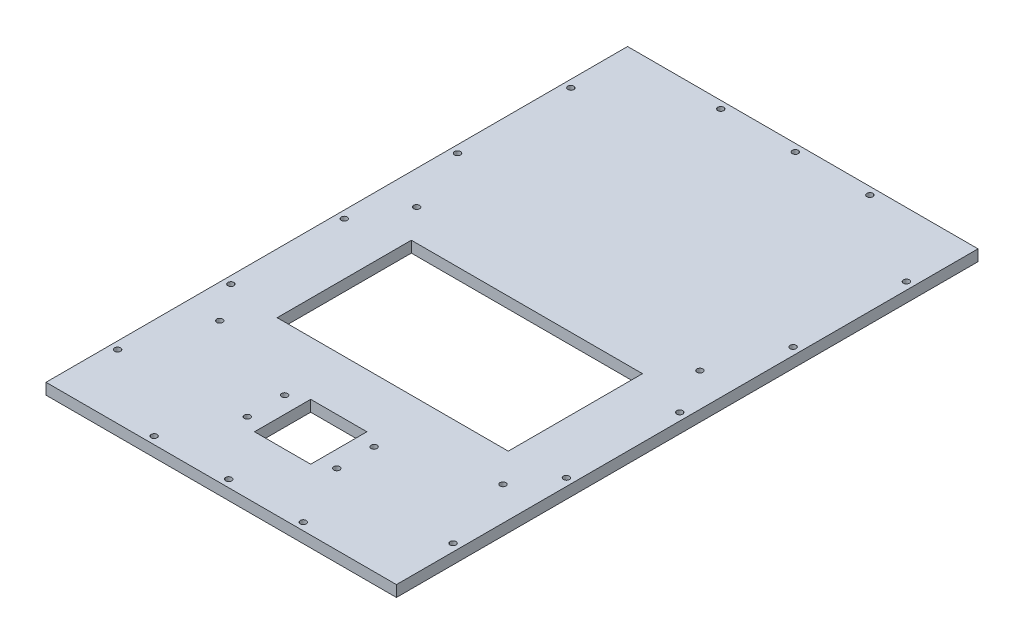
from build123d import *

# Parameters (mm, degrees)
SKETCH1_W                  = 298.45
SKETCH1_H                  = 495.3
BOSS_EXTRUDE1_DEPTH        = 4.7625
CUT_EXTRUDE1_DEPTH         = 290.291114191
CUT_EXTRUDE1_DEPTH_BACK    = 290.291114191
SKETCH3_W                  = 196.85
SKETCH3_H                  = 114.3
SKETCH20_W                 = 47.879
SKETCH20_H                 = 47.879
CUT_EXTRUDE5_DEPTH         = 290.291114191
F_10_CLEARANCE_HOLE1_D     = 5.1054
F_10_CLEARANCE_HOLE1_DEPTH = 10.668
F_10_CLEARANCE_HOLE1_TIP   = 1.533816902
F_10_CLEARANCE_HOLE4_D     = 5.1054
LPATTERN3_COUNT            = 3
LPATTERN3_PITCH            = 63.5
MIRROR2_COPY_1_D           = 5.1054
MIRROR2_COPY_2_D           = 5.1054
F_10_CLEARANCE_HOLE5_D     = 5.1054
LPATTERN4_COUNT            = 3
LPATTERN4_PITCH            = 96.52
LPATTERN4_COL_COUNT        = 3
LPATTERN4_COL_PITCH        = 96.52
MIRROR3_COPY_1_D           = 5.1054
MIRROR3_COPY_2_D           = 5.1054
MIRROR3_COPY_3_D           = 5.1054
MIRROR3_COPY_4_D           = 5.1054
F_10_CLEARANCE_HOLE6_D     = 5.1054


with BuildPart() as part:
    # Sketch1 → Boss-Extrude1 (new, symmetric)
    with BuildSketch(Plane(origin=(0, 0, 0), x_dir=(1, 0, 0), z_dir=(0, 1, 0))):
        Rectangle(SKETCH1_W, SKETCH1_H)
    extrude(amount=BOSS_EXTRUDE1_DEPTH, both=True)

    # Sketch3 → Cut-Extrude1 (cut, two sides: drawn at the far end of the back side and taken through both)
    with BuildSketch(Plane(origin=(0, 4.7625, 0), x_dir=(1, 0, 0), z_dir=(0, 1, 0)).offset(-CUT_EXTRUDE1_DEPTH_BACK)):
        with Locations((0, -44.45)):
            Rectangle(SKETCH3_W, SKETCH3_H)
    extrude(amount=CUT_EXTRUDE1_DEPTH + CUT_EXTRUDE1_DEPTH_BACK, mode=Mode.SUBTRACT)

    # Sketch20 → Cut-Extrude5 (cut, through all)
    with BuildSketch(Plane.XZ.offset(4.7625)):
        with Locations((0, 171.45)):
            Rectangle(SKETCH20_W, SKETCH20_H)
    extrude(amount=-CUT_EXTRUDE5_DEPTH, mode=Mode.SUBTRACT)

    # #10 Clearance Hole1
    with Locations(Plane(origin=(0, -4.7625, 0), x_dir=(-1, 0, 0), z_dir=(0, -1, 0))):
        with Locations((-38.1, -155.575), (38.1, -155.575), (38.1, -187.325), (-38.1, -187.325)):
            Hole(F_10_CLEARANCE_HOLE1_D / 2, depth=F_10_CLEARANCE_HOLE1_DEPTH)
            with Locations((0, 0, -(F_10_CLEARANCE_HOLE1_DEPTH + F_10_CLEARANCE_HOLE1_TIP / 2))):  # 118° drill point
                Cone(0, F_10_CLEARANCE_HOLE1_D / 2, F_10_CLEARANCE_HOLE1_TIP, mode=Mode.SUBTRACT)

    # #10 Clearance Hole4 (through all)
    with Locations(Plane(origin=(0, 4.7625, 0), x_dir=(1, 0, 0), z_dir=(0, 1, 0))):
        with Locations((-63.5, 241.3)):
            f_10_clearance_hole4 = Hole(F_10_CLEARANCE_HOLE4_D / 2)

    # LPattern3: #10 Clearance Hole4 ×3
    with Locations(*[(i * LPATTERN3_PITCH, 0, 0) for i in range(1, LPATTERN3_COUNT)]):
        add(f_10_clearance_hole4, mode=Mode.SUBTRACT)

    # Mirror2: #10 Clearance Hole4 across plane
    add(f_10_clearance_hole4.mirror(Plane.XY), mode=Mode.SUBTRACT)

    # Mirror2 copy 1 (through all)
    with Locations(Plane(origin=(63.5, 4.7625, 0), x_dir=(1, 0, 0), z_dir=(0, 1, 0))):
        with Locations((-63.5, -241.3)):
            Hole(MIRROR2_COPY_1_D / 2)

    # Mirror2 copy 2 (through all)
    with Locations(Plane(origin=(127, 4.7625, 0), x_dir=(1, 0, 0), z_dir=(0, 1, 0))):
        with Locations((-63.5, -241.3)):
            Hole(MIRROR2_COPY_2_D / 2)

    # #10 Clearance Hole5 (through all)
    with Locations(Plane(origin=(0, 4.7625, 0), x_dir=(1, 0, 0), z_dir=(0, 1, 0))):
        with Locations((-142.875, 0)):
            f_10_clearance_hole5 = Hole(F_10_CLEARANCE_HOLE5_D / 2)

    # LPattern4: #10 Clearance Hole5 ×3
    with Locations(*[(0, 0, -i * LPATTERN4_PITCH) for i in range(1, LPATTERN4_COUNT)]):
        add(f_10_clearance_hole5, mode=Mode.SUBTRACT)

    # LPattern4 col: #10 Clearance Hole5 ×3
    with Locations(*[(0, 0, i * LPATTERN4_COL_PITCH) for i in range(1, LPATTERN4_COL_COUNT)]):
        add(f_10_clearance_hole5, mode=Mode.SUBTRACT)

    # Mirror3: #10 Clearance Hole5 across plane
    add(f_10_clearance_hole5.mirror(Plane(origin=(0, 0, 0), x_dir=(0, 0, 1), z_dir=(1, 0, 0))), mode=Mode.SUBTRACT)

    # Mirror3 copy 1 (through all)
    with Locations(Plane(origin=(0, 4.7625, -96.52), x_dir=(-1, 0, 0), z_dir=(0, 1, 0))):
        with Locations((-142.875, 0)):
            Hole(MIRROR3_COPY_1_D / 2)

    # Mirror3 copy 2 (through all)
    with Locations(Plane(origin=(0, 4.7625, -193.04), x_dir=(-1, 0, 0), z_dir=(0, 1, 0))):
        with Locations((-142.875, 0)):
            Hole(MIRROR3_COPY_2_D / 2)

    # Mirror3 copy 3 (through all)
    with Locations(Plane(origin=(0, 4.7625, 96.52), x_dir=(-1, 0, 0), z_dir=(0, 1, 0))):
        with Locations((-142.875, 0)):
            Hole(MIRROR3_COPY_3_D / 2)

    # Mirror3 copy 4 (through all)
    with Locations(Plane(origin=(0, 4.7625, 193.04), x_dir=(-1, 0, 0), z_dir=(0, 1, 0))):
        with Locations((-142.875, 0)):
            Hole(MIRROR3_COPY_4_D / 2)

    # #10 Clearance Hole6 (through all)
    with Locations(Plane(origin=(0, 4.7625, 0), x_dir=(1, 0, 0), z_dir=(0, 1, 0))):
        with Locations((120.65, 39.4255), (120.65, -128.3255), (-120.65, -128.3255), (-120.65, 39.4255)):
            Hole(F_10_CLEARANCE_HOLE6_D / 2)


solid = part.part
